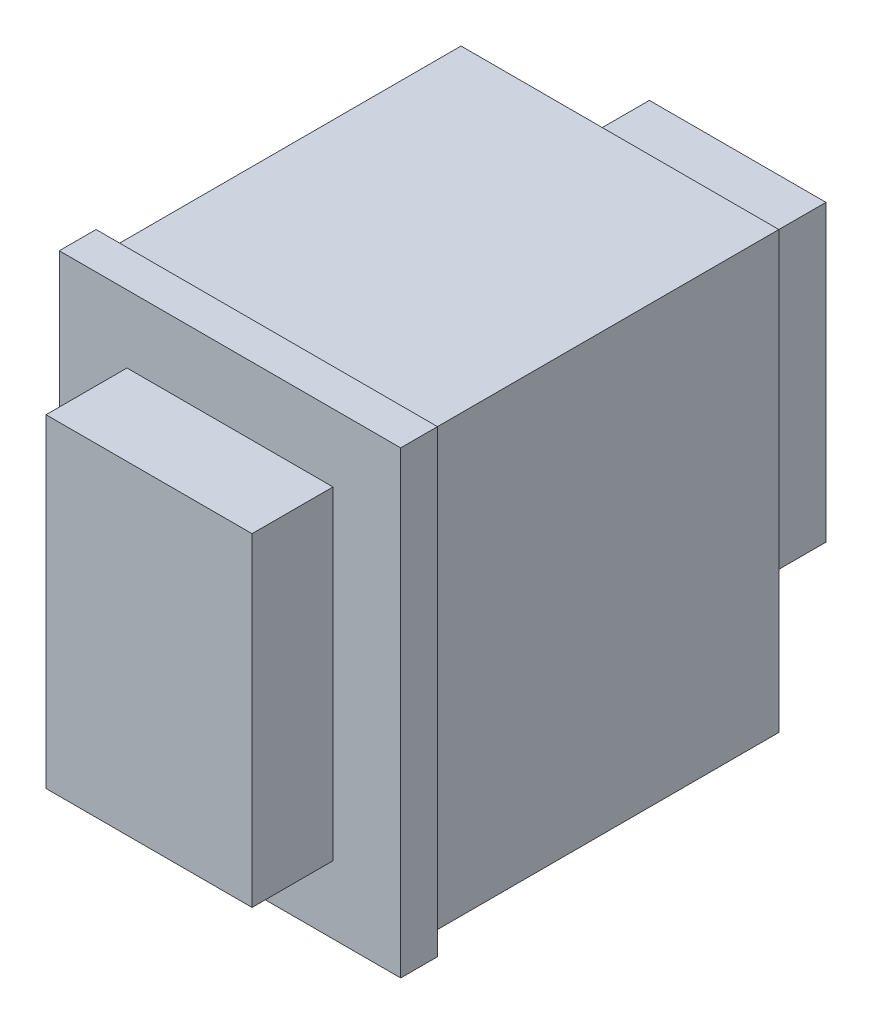
from build123d import *

# Parameters (mm, degrees)
SKETCH1_W       = 23.2
SKETCH1_H       = 31.2
BEZEL_DEPTH     = 2.5
SKETCH2_W       = 14
SKETCH2_H       = 22
ROCKER_DEPTH    = 5.5
SKETCH3_W       = 21.6
SKETCH3_H       = 29.6
BODY_DEPTH      = 24
SKETCH4_W       = 12
SKETCH4_H       = 20
TERMINALS_DEPTH = 8


with BuildPart() as part:
    # Sketch1 → Bezel (new body)
    with BuildSketch(Plane.XY):
        Rectangle(SKETCH1_W, SKETCH1_H)
    extrude(amount=BEZEL_DEPTH)

    # Sketch2 → Rocker (add)
    with BuildSketch(Plane.XY.offset(2.5)):
        Rectangle(SKETCH2_W, SKETCH2_H)
    extrude(amount=ROCKER_DEPTH)

    # Sketch3 → Body (add)
    with BuildSketch(Plane.XY.offset(-24)):
        Rectangle(SKETCH3_W, SKETCH3_H)
    extrude(amount=BODY_DEPTH)

    # Sketch4 → Terminals (add)
    with BuildSketch(Plane.XY.offset(-32)):
        Rectangle(SKETCH4_W, SKETCH4_H)
    extrude(amount=TERMINALS_DEPTH)


solid = part.part
